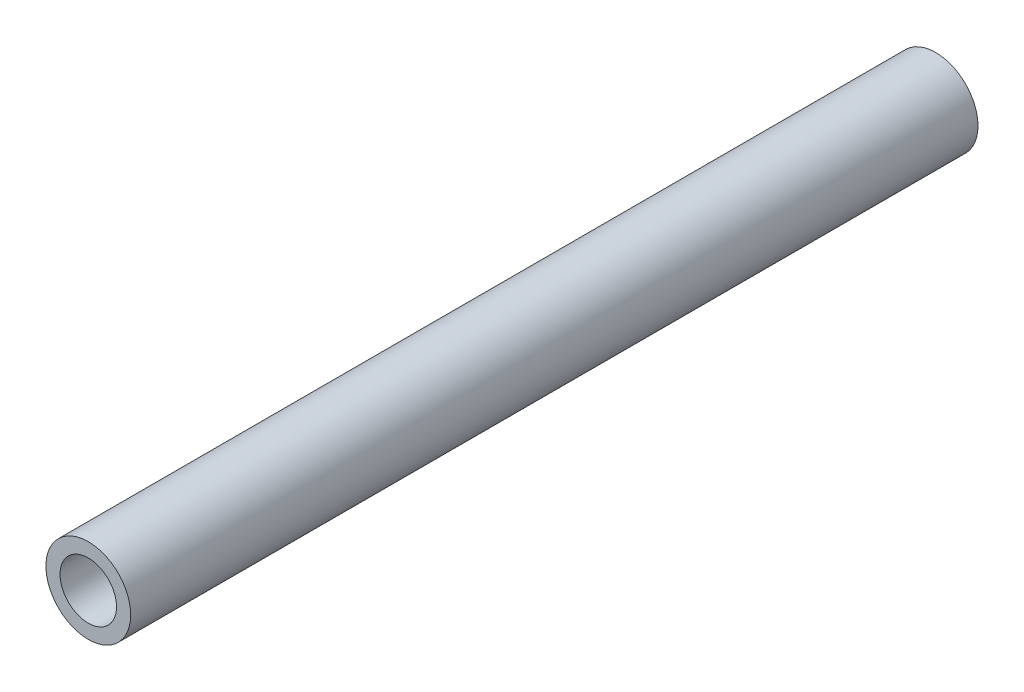
from build123d import *

# Parameters (mm, degrees)
SKETCH1_R           = 1.5
SKETCH1_R_2         = 1
BOSS_EXTRUDE1_DEPTH = 30


with BuildPart() as part:
    # Sketch1 → Boss-Extrude1 (new body)
    with BuildSketch(Plane.XY):
        with Locations((-0.992203806, 0.011518033)):
            Circle(SKETCH1_R)
        with Locations((-0.992203806, 0.011518033)):
            Circle(SKETCH1_R_2, mode=Mode.SUBTRACT)
    extrude(amount=BOSS_EXTRUDE1_DEPTH)


solid = part.part
